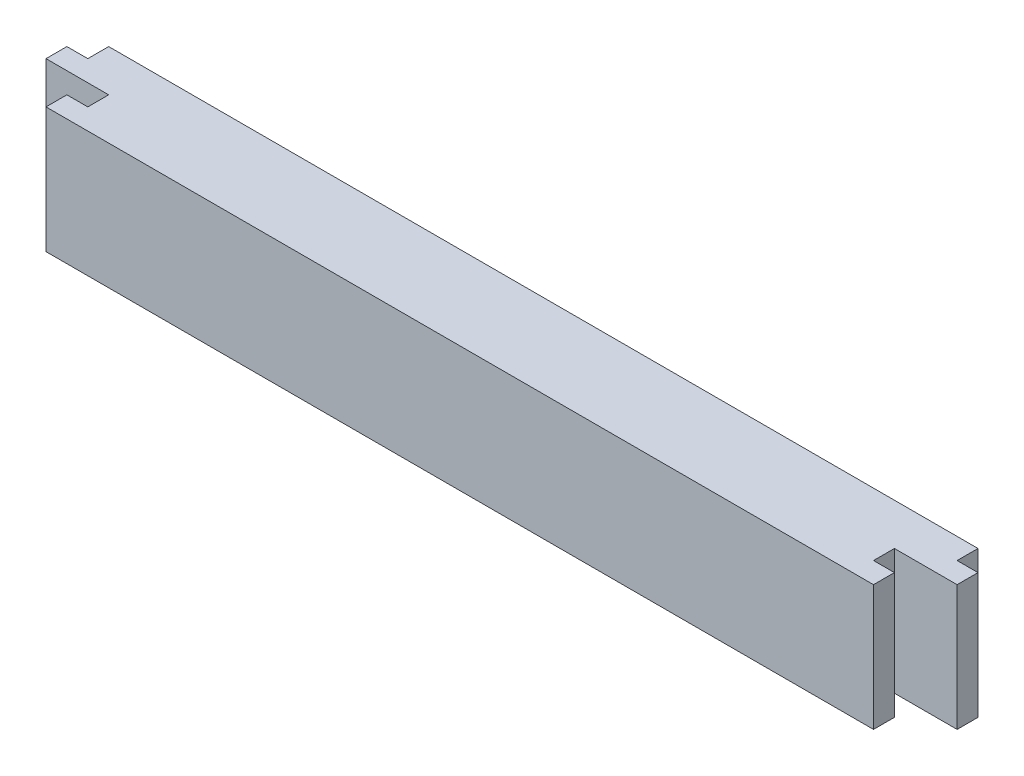
from build123d import *

# Parameters (mm, degrees)
TAPA_CAJA_PLACAS_SALIENTE_DEPTH = 7.5


with BuildPart() as part:
    # Tapa-Caja-Placas-Croquis → Tapa-Caja-Placas-Saliente (new body)
    with BuildSketch(Plane(origin=(0, 0, 0), x_dir=(1, 0, 0), z_dir=(0, 1, 0))):
        Polygon((-26, -1.25), (-23.5, -1.25), (-23.5, -2.5), (-24.75, -2.5), (-24.75, -3.75), (-23.5, -3.75), (23.5, -3.75), (24.75, -3.75), (24.75, -2.5), (23.5, -2.5), (23.5, -1.25), (26, -1.25), (27.25, -1.25), (27.25, 0), (26, 0), (26, 1.25), (-26, 1.25), (-26, 0), (-27.25, 0), (-27.25, -1.25), align=None)
    extrude(amount=TAPA_CAJA_PLACAS_SALIENTE_DEPTH)


solid = part.part
